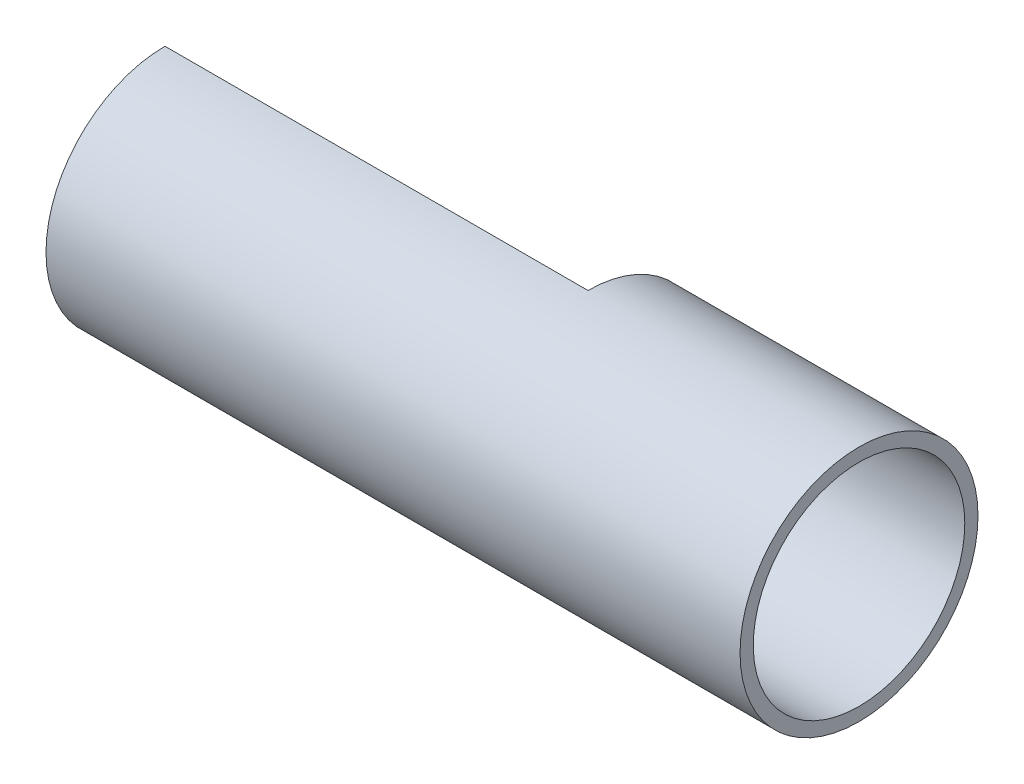
from build123d import *
from build123d.topology import SkipClean

# Parameters (mm, degrees)
SKETCH1_R              = 11.43
MAIN_SHAFT_DEPTH       = 33.3375
NEEDLE_HOLE_DEPTH      = 69.606453231
NEEDLE_HOLE_DEPTH_BACK = 69.606453231
SKETCH5_R              = 1.27
SKETCH7_R              = 10.16
SYRINGE_SLOT_DEPTH     = 40.132
SPRING_START           = -22.733
SKETCH9_R              = 10.16
SPRING_SLOT_DEPTH      = 22.733
TABS_START             = -1.27
TABS_DEPTH             = 1.27
SKETCH12_W             = 40.64
SKETCH12_H             = 22.86
SYRINGE_INSERT_DEPTH   = 43.734300331


with BuildPart() as part:
    # Sketch1 → Main Shaft (new, symmetric)
    with BuildSketch(Plane(origin=(0, 0, 0), x_dir=(0, 0, -1), z_dir=(1, 0, 0))):
        Circle(SKETCH1_R)
    extrude(amount=MAIN_SHAFT_DEPTH, both=True)

    # Sketch4 → Bumpout (revolve)
    with BuildSketch(Plane.XY):
        with BuildLine():
            Line((-33.3375, 0), (-33.3375, 6.35))
            ThreePointArc((-33.3375, 6.35), (-37.827628061, 4.490128061), (-39.6875, 0))
            Line((-39.6875, 0), (-33.3375, 0))
        make_face()
    revolve(axis=Axis((88.99, 0, 0), (-1, 0, 0)))

    # Sketch5 → Needle Hole (cut, two sides: drawn at the far end of the back side and taken through both)
    with BuildSketch(Plane.ZY.offset(33.3375).offset(-NEEDLE_HOLE_DEPTH_BACK)):
        with Locations(Location((0, 0, 0), (0, 0, 180))):
            Circle(SKETCH5_R)
    extrude(amount=NEEDLE_HOLE_DEPTH + NEEDLE_HOLE_DEPTH_BACK, mode=Mode.SUBTRACT)

    # Sketch7 → Syringe Slot (cut)
    with BuildSketch(Plane.ZY.offset(30.7975)):
        Circle(SKETCH7_R)
    extrude(amount=-SYRINGE_SLOT_DEPTH, mode=Mode.SUBTRACT)

    # Sketch9 → Spring Slot (cut)
    with BuildSketch(Plane(origin=(33.3375, 0, 0), x_dir=(0, 0, -1), z_dir=(1, 0, 0)).offset(SPRING_START)):
        with Locations(Location((0, 0, 0), (0, 0, 180))):
            Circle(SKETCH9_R)
    extrude(amount=SPRING_SLOT_DEPTH, mode=Mode.SUBTRACT)

    # Sketch11 → Tabs (cut)
    with SkipClean():  # the faces are left unmerged after this step: merging them gives an invalid solid
        with BuildSketch(Plane(origin=(10.6045, 0, 0), x_dir=(0, 0, -1), z_dir=(1, 0, 0)).offset(TABS_START)):
            with BuildLine():
                Line((-1.27, 8.798818102), (-1.451428571, 10.055792117))
                ThreePointArc((-1.451428571, 10.055792117), (-10.16, 0), (-1.451428571, -10.055792117))
                Line((-1.451428571, -10.055792117), (-1.27, -8.798818102))
                ThreePointArc((-1.27, -8.798818102), (-8.89, 0), (-1.27, 8.798818102))
            make_face()
            with BuildLine():
                Line((1.27, 8.798818102), (1.451428571, 10.055792117))
                ThreePointArc((1.451428571, 10.055792117), (10.16, 0), (1.451428571, -10.055792117))
                Line((1.451428571, -10.055792117), (1.27, -8.798818102))
                ThreePointArc((1.27, -8.798818102), (8.89, 0), (1.27, 8.798818102))
            make_face()
        extrude(amount=TABS_DEPTH, mode=Mode.SUBTRACT)

    # Sketch12 → Syringe Insert (cut, through all)
    with BuildSketch(Plane.XY):
        with Locations((-13.0175, 0)):
            Rectangle(SKETCH12_W, SKETCH12_H)
    extrude(amount=-SYRINGE_INSERT_DEPTH, mode=Mode.SUBTRACT)


solid = part.part
